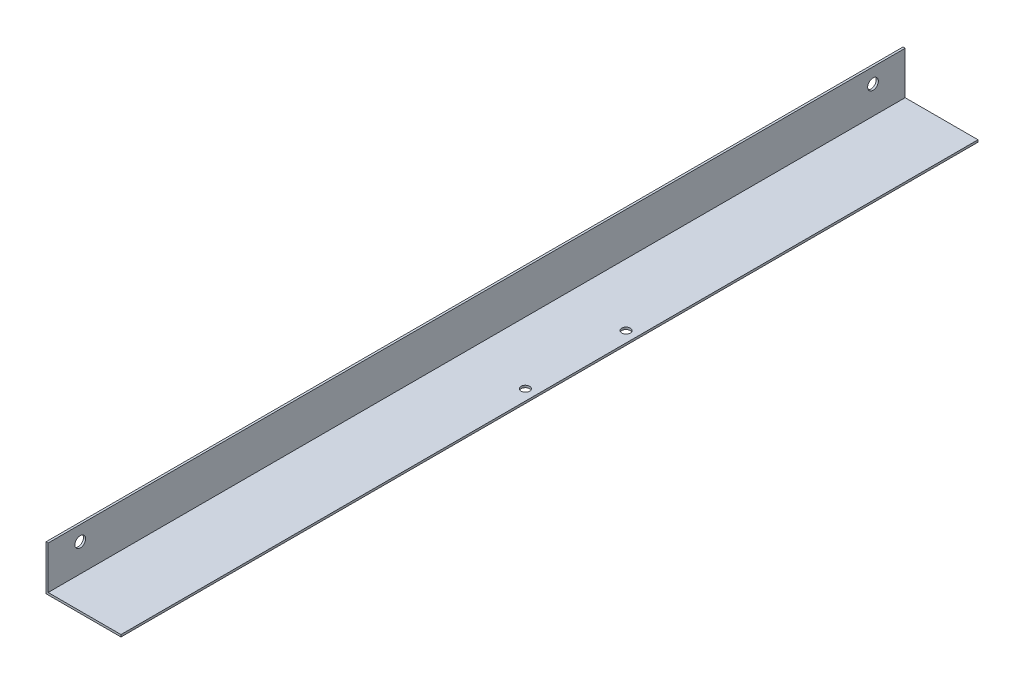
from build123d import *

# Parameters (mm, degrees)
BOSS_EXTRU_1_DEPTH      = 400
ESQUISSE3_R             = 2
ENL_V_MAT_EXTRU_2_DEPTH = 402.940294074
ESQUISSE4_R             = 2.5
ENL_V_MAT_EXTRU_3_DEPTH = 10


with BuildPart() as part:
    # Esquisse1 → Boss.-Extru.1 (new body)
    with BuildSketch(Plane.XY):
        Polygon((-1, -1), (-1, 20), (0, 20), (0, 0), (34, 0), (34, -1), align=None)
    extrude(amount=BOSS_EXTRU_1_DEPTH)

    # Esquisse3 → Enlèv. mat.-Extru.2 (cut, through all)
    with BuildSketch(Plane(origin=(0, 0, 0), x_dir=(1, 0, 0), z_dir=(0, 1, 0))):
        with Locations(Location((29, -206.260283716, 0), (0, 0, 270))):
            Circle(ESQUISSE3_R)
        with Locations(Location((29, -159.260283716, 0), (0, 0, 270))):
            Circle(ESQUISSE3_R)
    extrude(amount=-ENL_V_MAT_EXTRU_2_DEPTH, mode=Mode.SUBTRACT)

    # Esquisse4 → Enlèv. mat.-Extru.3 (cut)
    with BuildSketch(Plane.ZY.offset(1)):
        with Locations(Location((15, 13, 0), (0, 0, 270))):
            Circle(ESQUISSE4_R)
        with Locations(Location((385, 13, 0), (0, 0, 270))):
            Circle(ESQUISSE4_R)
    extrude(amount=-ENL_V_MAT_EXTRU_3_DEPTH, mode=Mode.SUBTRACT)


solid = part.part
